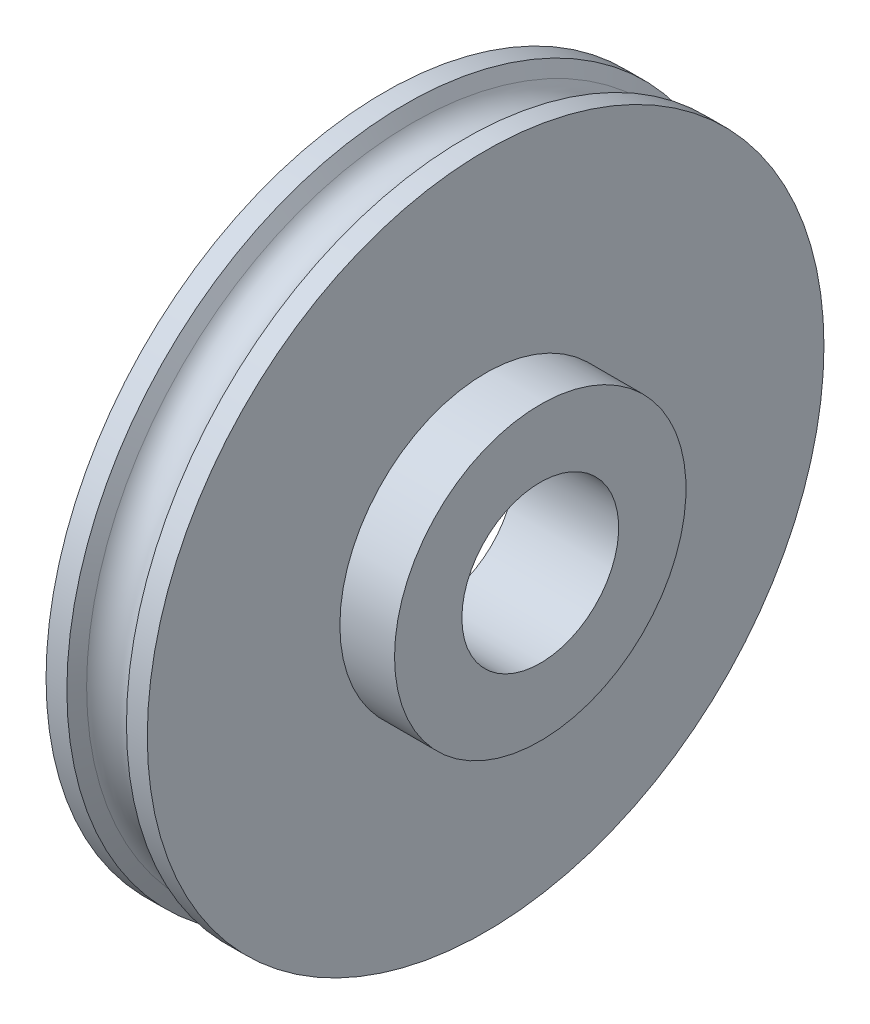
from build123d import *


with BuildPart() as part:
    # Sketch1 → Revolve1 (revolve)
    with BuildSketch(Plane.XY, mode=Mode.PRIVATE) as revolve1_sk:
        with BuildLine():
            Line((1, 4.04), (1, 1.506))
            Line((1, 1.506), (2.995, 1.506))
            Line((2.995, 1.506), (2.995, 2.8))
            Line((2.995, 2.8), (1.945, 2.8))
            Line((1.945, 2.8), (1.945, 6.5))
            Line((1.945, 6.5), (1.545, 6.5))
            Line((1.545, 6.5), (1.409181223, 6.256464562))
            ThreePointArc((1.409181223, 6.256464562), (0.9725, 6), (0.535818777, 6.256464562))
            Line((0.535818777, 6.256464562), (0.4, 6.5))
            Line((0.4, 6.5), (0, 6.5))
            Line((0, 6.5), (0, 4.04))
            Line((0, 4.04), (1, 4.04))
        make_face()
    revolve(revolve1_sk.sketch.rotate(Axis((0, 0, 0), (1, 0, 0)), 90), axis=Axis((0, 0, 0), (1, 0, 0)))


solid = part.part
